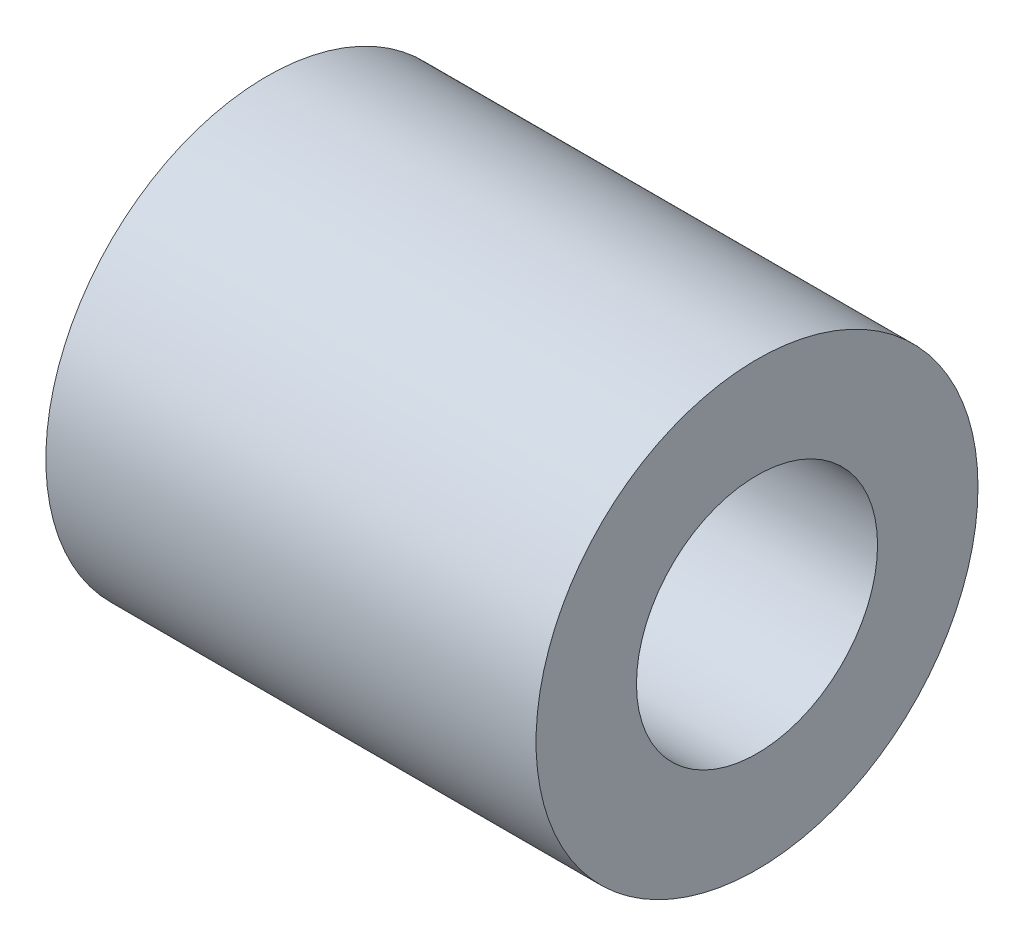
from build123d import *

# Parameters (mm, degrees)
SKETCH_1_R      = 5.5
SKETCH_1_R_2    = 3
EXTRUDE_1_DEPTH = 12.2


with BuildPart() as part:
    # 草图1 → 凸台-拉伸1 (new body)
    with BuildSketch(Plane(origin=(0, 0, 0), x_dir=(0, 0, -1), z_dir=(1, 0, 0))):
        Circle(SKETCH_1_R)
        Circle(SKETCH_1_R_2, mode=Mode.SUBTRACT)
    extrude(amount=EXTRUDE_1_DEPTH)


solid = part.part
